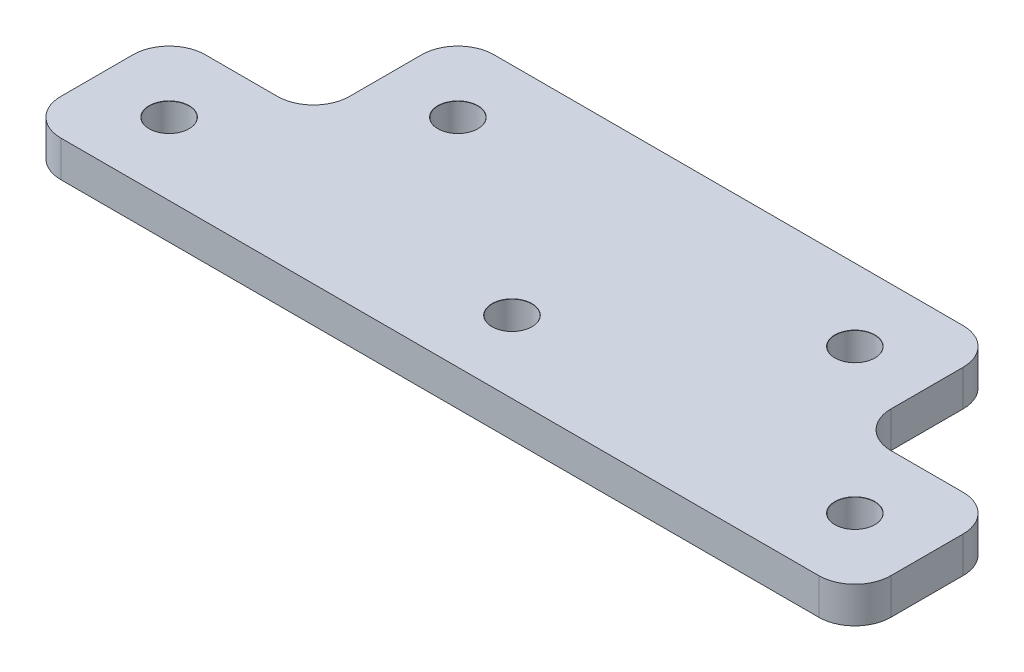
from build123d import *

# Parameters (mm, degrees)
BOSS_EXTRUDE1_DEPTH            = 5
FILLET2_R                      = 5
M5_CLEARANCE_HOLE1_D           = 5.5
M5_CLEARANCE_HOLE1_CSINK_D     = 5.55
M5_CLEARANCE_HOLE1_CSINK_ANGLE = 90
M5_CLEARANCE_HOLE2_D           = 5.5
M5_CLEARANCE_HOLE2_CSINK_D     = 5.55
M5_CLEARANCE_HOLE2_CSINK_ANGLE = 90
M5_CLEARANCE_HOLE3_D           = 5.5
M5_CLEARANCE_HOLE3_CSINK_D     = 5.55
M5_CLEARANCE_HOLE3_CSINK_ANGLE = 90


with BuildPart() as part:
    # Sketch2 → Boss-Extrude1 (new body)
    with BuildSketch(Plane(origin=(0, 0, 0), x_dir=(1, 0, 0), z_dir=(0, 1, 0))):
        Polygon((-57.5, 0), (57.5, 0), (57.5, 20), (37.5, 20), (37.5, 40), (-37.5, 40), (-37.5, 20), (-57.5, 20), align=None)
    extrude(amount=BOSS_EXTRUDE1_DEPTH)

    # Fillet2
    fillet2_edges = [part.edges().sort_by_distance(p)[0] for p in [
        (37.5, 2.5, -20),
        (57.5, 2.5, -20),
        (57.5, 2.5, 0),
        (-57.5, 2.5, 0),
        (-57.5, 2.5, -20),
        (-37.5, 2.5, -20),
        (-37.5, 2.5, -40),
        (37.5, 2.5, -40),
    ]]
    fillet(fillet2_edges, radius=FILLET2_R)

    # M5 Clearance Hole1 (through all)
    with Locations(Plane(origin=(-27.5, 5, -30), x_dir=(0, 0, 1), z_dir=(0, 1, 0))):
        with Locations((0, 0)):
            m5_clearance_hole1 = CounterSinkHole(M5_CLEARANCE_HOLE1_D / 2, M5_CLEARANCE_HOLE1_CSINK_D / 2, counter_sink_angle=M5_CLEARANCE_HOLE1_CSINK_ANGLE)

    # Mirror1: M5 Clearance Hole1 across plane
    add(m5_clearance_hole1.mirror(Plane(origin=(0, 0, 0), x_dir=(0, 0, 1), z_dir=(1, 0, 0))), mode=Mode.SUBTRACT)

    # M5 Clearance Hole2 (through all)
    with Locations(Plane(origin=(-47.5, 5, -10), x_dir=(0, 0, 1), z_dir=(0, 1, 0))):
        with Locations((0, 0)):
            m5_clearance_hole2 = CounterSinkHole(M5_CLEARANCE_HOLE2_D / 2, M5_CLEARANCE_HOLE2_CSINK_D / 2, counter_sink_angle=M5_CLEARANCE_HOLE2_CSINK_ANGLE)

    # Mirror2: M5 Clearance Hole2 across plane
    add(m5_clearance_hole2.mirror(Plane(origin=(0, 0, 0), x_dir=(0, 0, 1), z_dir=(1, 0, 0))), mode=Mode.SUBTRACT)

    # M5 Clearance Hole3 (through all)
    with Locations(Plane(origin=(0, 5, -10), x_dir=(0, 0, 1), z_dir=(0, 1, 0))):
        with Locations((0, 0)):
            CounterSinkHole(M5_CLEARANCE_HOLE3_D / 2, M5_CLEARANCE_HOLE3_CSINK_D / 2, counter_sink_angle=M5_CLEARANCE_HOLE3_CSINK_ANGLE)


solid = part.part
